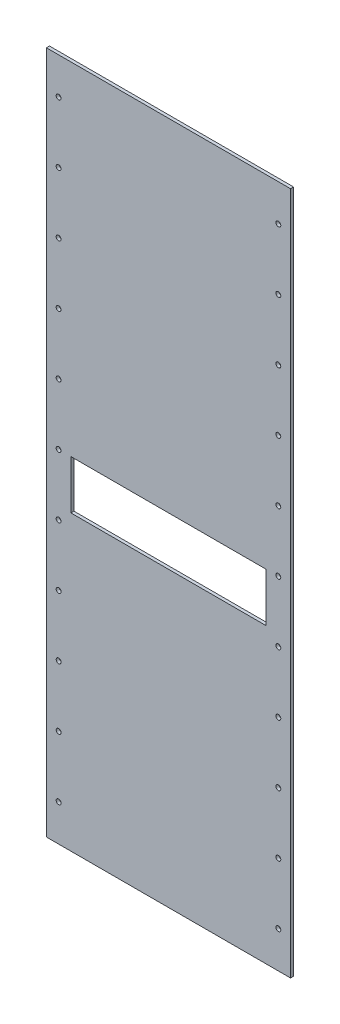
from build123d import *

# Parameters (mm, degrees)
SKETCH1_W              = 254
SKETCH1_H              = 711.2
BOSS_EXTRUDE1_DEPTH    = 3.175
F_10_CLEARANCE_HOLE1_D = 5.1054
LPATTERN1_COUNT        = 11
LPATTERN1_PITCH        = 63.5
SKETCH7_W              = 203.2
SKETCH7_H              = 50.8
CUT_EXTRUDE1_DEPTH     = 756.20296651


with BuildPart() as part:
    # Sketch1 → Boss-Extrude1 (new body)
    with BuildSketch(Plane.XY):
        with Locations((-127, 355.6)):
            Rectangle(SKETCH1_W, SKETCH1_H)
    extrude(amount=BOSS_EXTRUDE1_DEPTH)

    # #10 Clearance Hole1 (through all)
    with Locations(Plane.XY.offset(3.175)):
        with Locations((-241.3, 673.1), (-12.7, 673.1)):
            f_10_clearance_hole1 = Hole(F_10_CLEARANCE_HOLE1_D / 2)

    # LPattern1: #10 Clearance Hole1 ×11
    with Locations(*[(0, -i * LPATTERN1_PITCH, 0) for i in range(1, LPATTERN1_COUNT)]):
        add(f_10_clearance_hole1, mode=Mode.SUBTRACT)

    # Sketch7 → Cut-Extrude1 (cut, through all)
    with BuildSketch(Plane(origin=(0, 0, 0), x_dir=(-1, 0, 0), z_dir=(0, 0, -1))):
        with Locations((127, 330.2)):
            Rectangle(SKETCH7_W, SKETCH7_H)
    extrude(amount=-CUT_EXTRUDE1_DEPTH, mode=Mode.SUBTRACT)


solid = part.part
